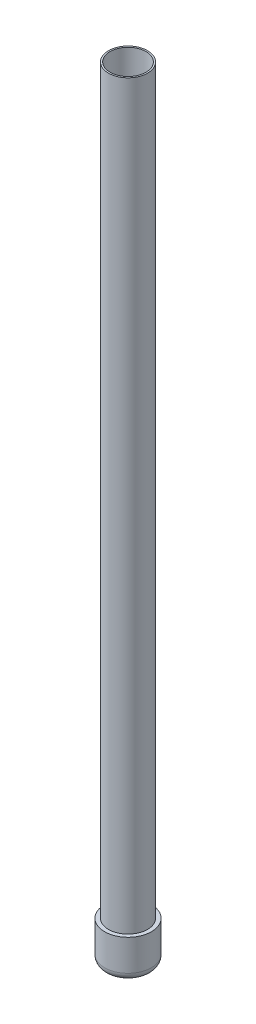
from build123d import *

# Parameters (mm, degrees)
SKETCH1_R           = 12.5
BOSS_EXTRUDE1_DEPTH = 500
SKETCH3_R           = 15
BOSS_EXTRUDE2_DEPTH = 25
FILLET2_R           = 5
SHELL1_T            = -1


with BuildPart() as part:
    # Sketch1 → Boss-Extrude1 (new body)
    with BuildSketch(Plane(origin=(0, 0, 0), x_dir=(1, 0, 0), z_dir=(0, 1, 0))):
        with Locations(Location((0, 0, 0), (0, 0, 270))):
            Circle(SKETCH1_R)
    extrude(amount=BOSS_EXTRUDE1_DEPTH)

    # Sketch3 → Boss-Extrude2 (add)
    with BuildSketch(Plane.XZ):
        with Locations(Location((0, 0, 0), (0, 0, 270))):
            Circle(SKETCH3_R)
    extrude(amount=-BOSS_EXTRUDE2_DEPTH)

    # Fillet2
    fillet2_edges = [part.edges().sort_by_distance(p)[0] for p in [
        (0, 0, 15),
    ]]
    fillet(fillet2_edges, radius=FILLET2_R)

    # Shell1
    shell1_openings = [part.faces().sort_by_distance(p)[0] for p in [
        (0, 500, 0),
    ]]
    offset(amount=SHELL1_T, openings=shell1_openings, kind=Kind.INTERSECTION)


solid = part.part
